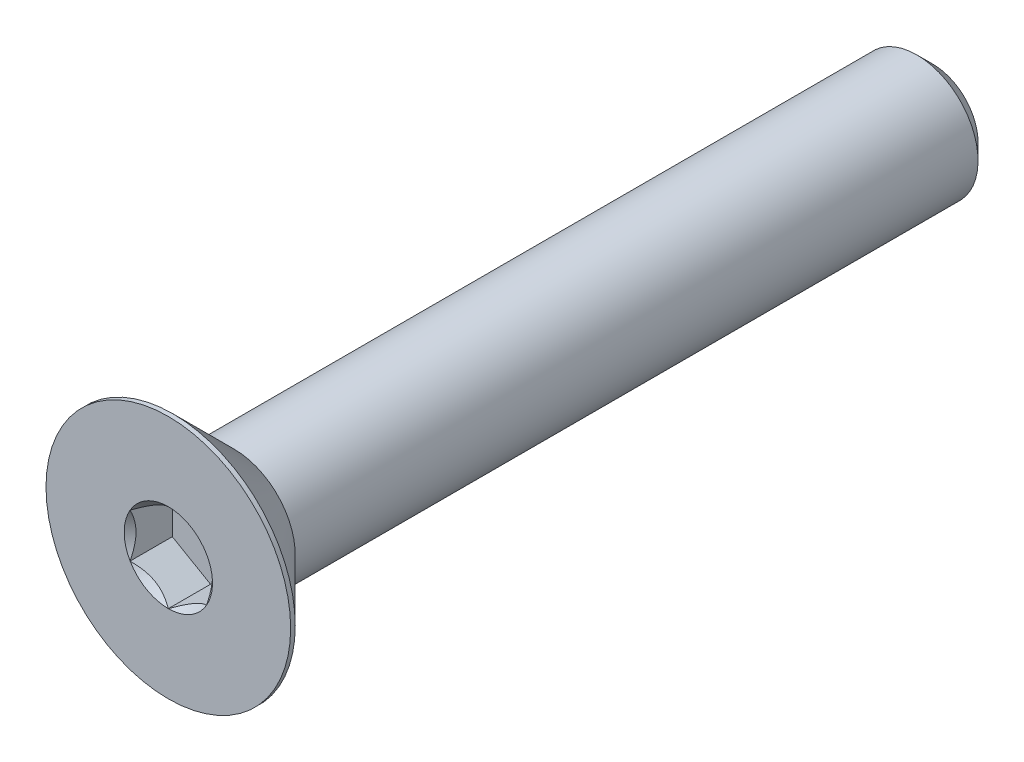
from build123d import *

# Parameters (mm, degrees)
CUT_EXTRUDE2_DEPTH = 1.38
SKETCH6_R          = 1.443375673
CUT_EXTRUDE3_DEPTH = 1.38
CUT_EXTRUDE3_TAPER = 45


with BuildPart() as part:
    # Sketch14 → Revolve1 (revolve)
    with BuildSketch(Plane(origin=(0, 0, 0), x_dir=(0, 0, -1), z_dir=(1, 0, 0))):
        Polygon((-2.3, 0), (-2.3, 4), (-2.15, 4), (-0.15, 2), (0, 2), (22.175, 2), (22.7, 1.475), (22.7, 0), align=None)
    revolve(axis=Axis((0, 0, -22.7), (0, 0, 1)))

    # Sketch5 → Cut-Extrude2 (cut)
    with BuildSketch(Plane.XY.offset(2.3)):
        Polygon((0, -1.443375673), (1.25, -0.721687836), (1.25, 0.721687836), (0, 1.443375673), (-1.25, 0.721687836), (-1.25, -0.721687836), align=None)
    extrude(amount=-CUT_EXTRUDE2_DEPTH, mode=Mode.SUBTRACT)

    # Sketch6 → Cut-Extrude3 (cut)
    with BuildSketch(Plane.XY.offset(2.3)):
        Circle(SKETCH6_R)
    extrude(amount=-CUT_EXTRUDE3_DEPTH, taper=CUT_EXTRUDE3_TAPER, mode=Mode.SUBTRACT)


solid = part.part
